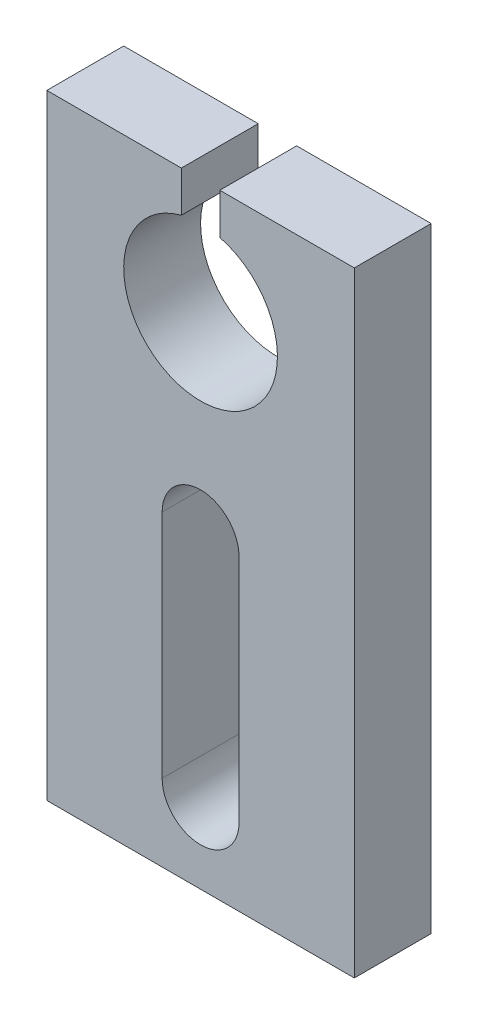
from build123d import *

# Parameters (mm, degrees)
SKETCH1_W           = 25.4
SKETCH1_H           = 50.8
BOSS_EXTRUDE1_DEPTH = 6.35
CUT_EXTRUDE1_DEPTH  = 30.099355663
CUT_EXTRUDE2_DEPTH  = 30.099355663


with BuildPart() as part:
    # Sketch1 → Boss-Extrude1 (new body)
    with BuildSketch(Plane.XY):
        Rectangle(SKETCH1_W, SKETCH1_H)
    extrude(amount=BOSS_EXTRUDE1_DEPTH)

    # Sketch2 → Cut-Extrude1 (cut, through all)
    with BuildSketch(Plane.XY.offset(6.35)):
        with BuildLine():
            Line((-1.5875, 22.023361062), (-1.5875, 14.440204949))
            Line((-1.5875, 14.440204949), (1.5875, 14.440204949))
            Line((1.5875, 14.440204949), (1.5875, 22.023361062))
            ThreePointArc((1.5875, 22.023361062), (0, 22.225), (-1.5875, 22.023361062))
        make_face()
        with BuildLine():
            Line((1.5875, 14.440204949), (-1.5875, 14.440204949))
            Line((-1.5875, 14.440204949), (-1.5875, 22.023361062))
            ThreePointArc((-1.5875, 22.023361062), (-3.888564967, 10.854884214), (6.35, 15.875))
            ThreePointArc((6.35, 15.875), (5.020115786, 19.763564967), (1.5875, 22.023361062))
            Line((1.5875, 22.023361062), (1.5875, 14.440204949))
        make_face()
        with BuildLine():
            Line((-1.5875, 25.4), (-1.5875, 22.023361062))
            ThreePointArc((-1.5875, 22.023361062), (0, 22.225), (1.5875, 22.023361062))
            Line((1.5875, 22.023361062), (1.5875, 25.4))
            Line((1.5875, 25.4), (-1.5875, 25.4))
        make_face()
    extrude(amount=-CUT_EXTRUDE1_DEPTH, mode=Mode.SUBTRACT)

    # Sketch3 → Cut-Extrude2 (cut, through all)
    with BuildSketch(Plane.XY.offset(6.35)):
        with BuildLine():
            Line((-3.175, -19.05), (-3.175, 0))
            ThreePointArc((-3.175, 0), (0, 3.175), (3.175, 0))
            Line((3.175, 0), (3.175, -19.05))
            ThreePointArc((3.175, -19.05), (0, -22.225), (-3.175, -19.05))
        make_face()
    extrude(amount=-CUT_EXTRUDE2_DEPTH, mode=Mode.SUBTRACT)


solid = part.part
